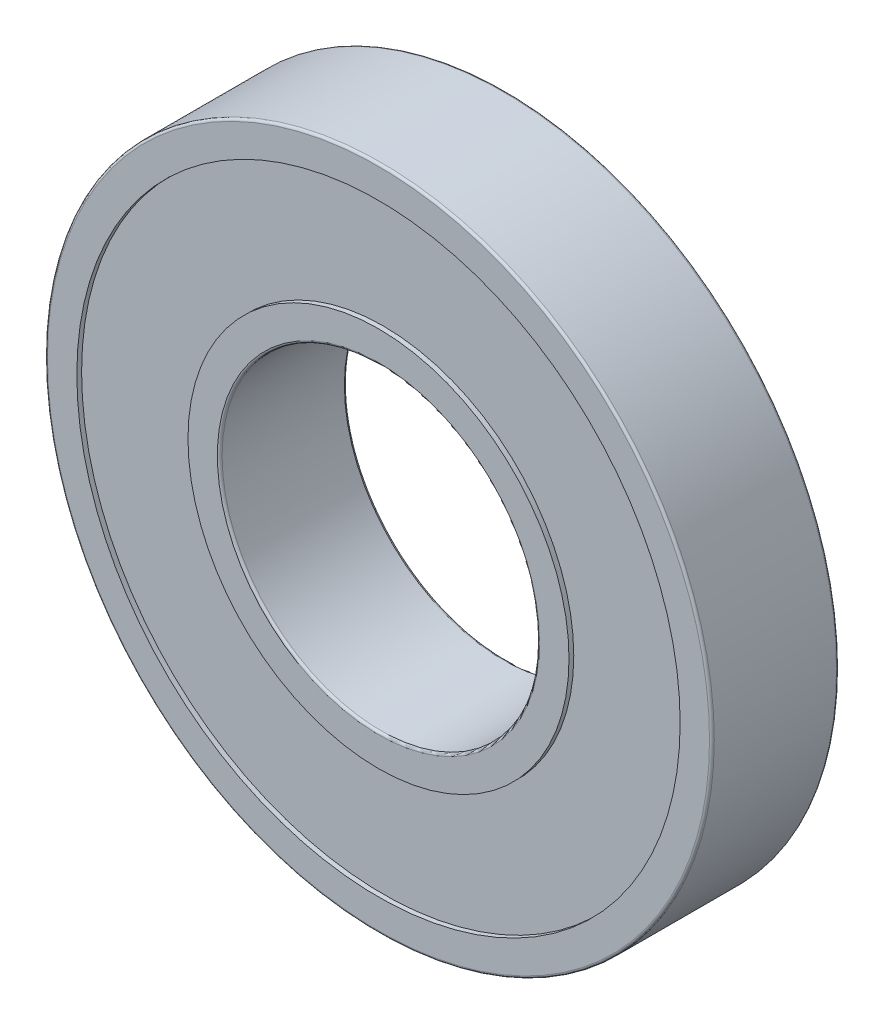
from build123d import *

# Parameters (mm, degrees)
SKETCH1_R           = 21
SKETCH1_R_2         = 10
BOSS_EXTRUDE1_DEPTH = 8
SKETCH2_R           = 19
SKETCH2_R_2         = 12
CUT_EXTRUDE1_DEPTH  = 0.3
CUT_EXTRUDE2_START  = -7.5
SKETCH2_2_R         = 19
SKETCH2_2_R_2       = 12
CUT_EXTRUDE2_DEPTH  = 0.5
FILLET1_R           = 0.15


with BuildPart() as part:
    # Sketch1 → Boss-Extrude1 (new body)
    with BuildSketch(Plane.XY):
        Circle(SKETCH1_R)
        Circle(SKETCH1_R_2, mode=Mode.SUBTRACT)
    extrude(amount=BOSS_EXTRUDE1_DEPTH)

    # Sketch2 → Cut-Extrude1 (cut)
    with BuildSketch(Plane.XY.offset(8)):
        Circle(SKETCH2_R)
        Circle(SKETCH2_R_2, mode=Mode.SUBTRACT)
    extrude(amount=-CUT_EXTRUDE1_DEPTH, mode=Mode.SUBTRACT)

    # Sketch2<2> → Cut-Extrude2 (cut)
    with BuildSketch(Plane.XY.offset(8).offset(CUT_EXTRUDE2_START)):
        Circle(SKETCH2_2_R)
        Circle(SKETCH2_2_R_2, mode=Mode.SUBTRACT)
    extrude(amount=-CUT_EXTRUDE2_DEPTH, mode=Mode.SUBTRACT)

    # Fillet1
    fillet1_edges = [part.edges().sort_by_distance(p)[0] for p in [
        (-21, 0, 0),
        (-21, 0, 8),
        (-10, 0, 0),
        (-10, 0, 8),
    ]]
    fillet(fillet1_edges, radius=FILLET1_R)


solid = part.part
